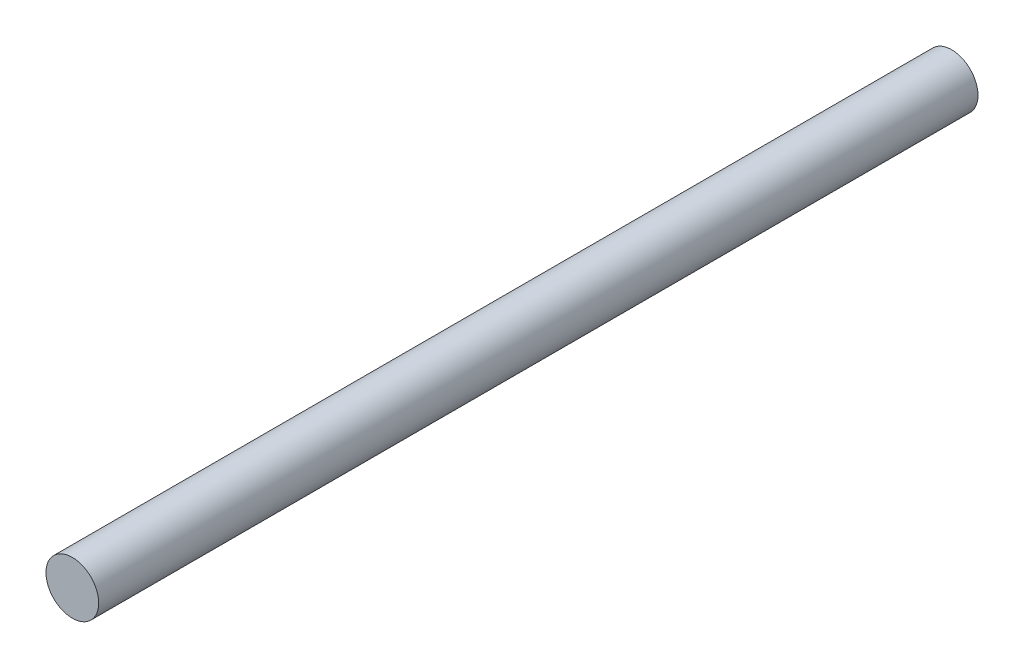
from build123d import *

# Parameters (mm, degrees)
SKIZZE1_R                       = 6
AUFSATZ_LINEAR_AUSTRAGEN1_DEPTH = 200


with BuildPart() as part:
    # Skizze1 → Aufsatz-Linear austragen1 (new body)
    with BuildSketch(Plane.XY):
        Circle(SKIZZE1_R)
    extrude(amount=AUFSATZ_LINEAR_AUSTRAGEN1_DEPTH)


solid = part.part
